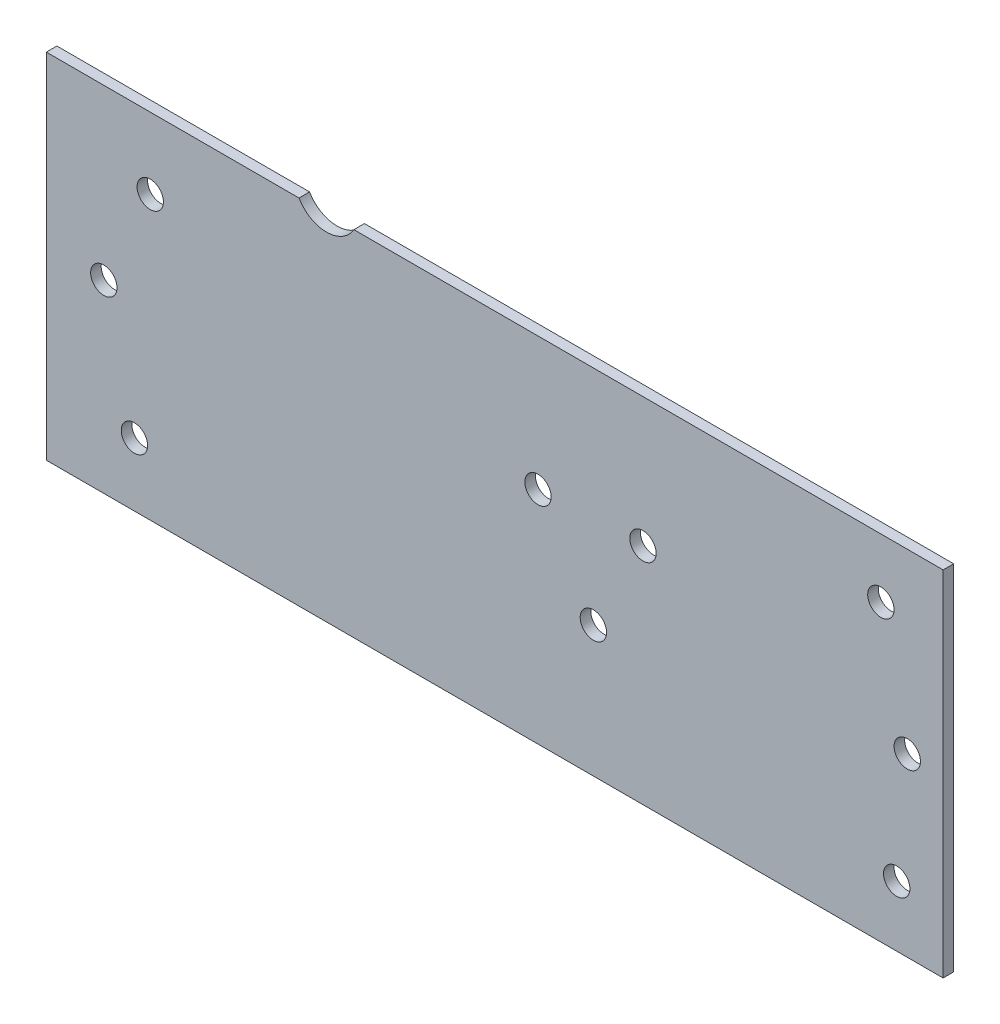
from build123d import *

# Parameters (mm, degrees)
SKETCH1_R           = 2.5
BOSS_EXTRUDE1_DEPTH = 2


with BuildPart() as part:
    # Sketch1 → Boss-Extrude1 (new body)
    with BuildSketch(Plane.XY):
        with BuildLine():
            Line((-85, 33.5), (-85, -33.5))
            Line((-85, -33.5), (85, -33.5))
            Line((85, -33.5), (85, 33.5))
            Line((85, 33.5), (-26.703847577, 33.5))
            ThreePointArc((-26.703847577, 33.5), (-31.9, 30.5), (-37.096152423, 33.5))
            Line((-37.096152423, 33.5), (-85, 33.5))
        make_face()
        with Locations((-68.3, -21.5)):
            Circle(SKETCH1_R, mode=Mode.SUBTRACT)
        with Locations((-74.1, 1.5)):
            Circle(SKETCH1_R, mode=Mode.SUBTRACT)
        with Locations((76.2, -22)):
            Circle(SKETCH1_R, mode=Mode.SUBTRACT)
        with Locations((18.7, -8.7)):
            Circle(SKETCH1_R, mode=Mode.SUBTRACT)
        with Locations((78.2, -0.1)):
            Circle(SKETCH1_R, mode=Mode.SUBTRACT)
        with Locations((-65.3, 20)):
            Circle(SKETCH1_R, mode=Mode.SUBTRACT)
        with Locations((8.2, 8.3)):
            Circle(SKETCH1_R, mode=Mode.SUBTRACT)
        with Locations((28.1, 9)):
            Circle(SKETCH1_R, mode=Mode.SUBTRACT)
        with Locations((73.2, 22.3)):
            Circle(SKETCH1_R, mode=Mode.SUBTRACT)
    extrude(amount=BOSS_EXTRUDE1_DEPTH)


solid = part.part
